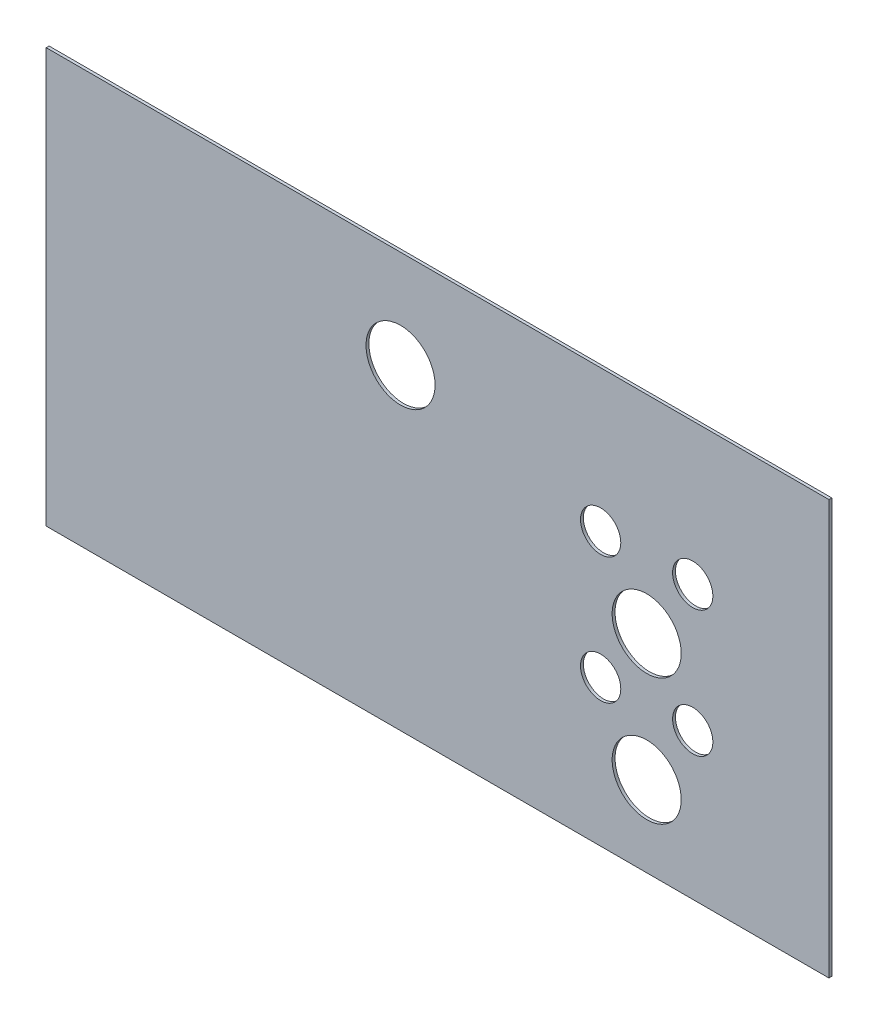
from build123d import *

# Parameters (mm, degrees)
SKETCH1_W           = 863.6
SKETCH1_H           = 457.2
BOSS_EXTRUDE1_DEPTH = 3.175
SKETCH2_R           = 38.1
SKETCH2_R_2         = 22.225
CUT_EXTRUDE1_DEPTH  = 489.589071332


with BuildPart() as part:
    # Sketch1 → Boss-Extrude1 (new body)
    with BuildSketch(Plane.XY):
        Rectangle(SKETCH1_W, SKETCH1_H)
    extrude(amount=BOSS_EXTRUDE1_DEPTH)

    # Sketch2 → Cut-Extrude1 (cut, through all)
    with BuildSketch(Plane.XY.offset(3.175)):
        with Locations((230.738100004, 0)):
            Circle(SKETCH2_R)
        with Locations((230.738100004, -139.7)):
            Circle(SKETCH2_R)
        with Locations((179.938100004, -67.222799997)):
            Circle(SKETCH2_R_2)
        with Locations((281.538100004, -67.222799997)):
            Circle(SKETCH2_R_2)
        with Locations((179.938100004, 72.477200003)):
            Circle(SKETCH2_R_2)
        with Locations((281.538100004, 72.477200003)):
            Circle(SKETCH2_R_2)
        with Locations((-40.855899988, 120.65)):
            Circle(SKETCH2_R)
    extrude(amount=-CUT_EXTRUDE1_DEPTH, mode=Mode.SUBTRACT)


solid = part.part
